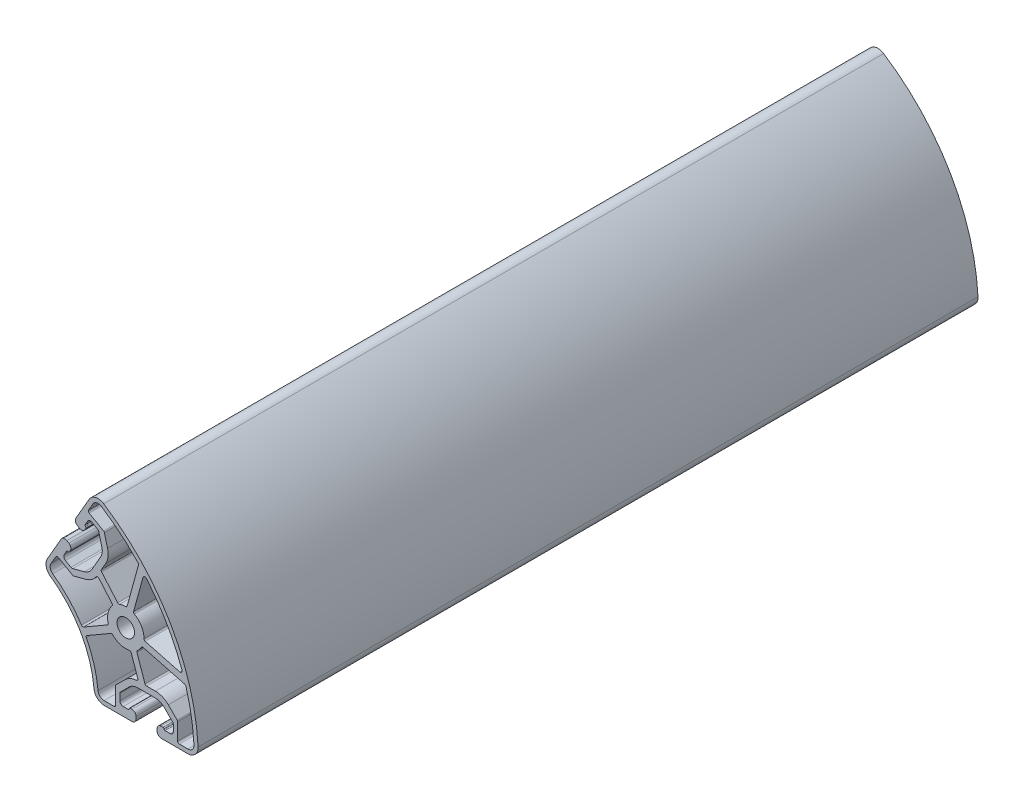
from build123d import *

# Parameters (mm, degrees)
SKETCH1_R      = 3.3782
EXTRUDE1_DEPTH = 300


with BuildPart() as part:
    # Sketch1 → Extrude1 (new body)
    with BuildSketch(Plane.XY):
        with BuildLine():
            Line((13.593641298, -30.057963868), (23.832349548, -30.057963868))
            ThreePointArc((23.832349548, -30.057963868), (26.73425855, -28.810948457), (27.826804928, -25.847425942))
            ThreePointArc((27.826804928, -25.847425942), (17.219715771, 9.94183955), (-8.471171519, 37.022463159))
            ThreePointArc((-8.471171519, 37.022463159), (-11.583933807, 37.558048634), (-14.114834107, 35.668423132))
            Line((-14.114834107, 35.668423132), (-19.234198804, 26.801378173))
            ThreePointArc((-19.234198804, 26.801378173), (-19.344009363, 25.628704588), (-18.618391717, 24.700965008))
            Line((-18.618391717, 24.700965008), (-17.826596053, 24.243823899))
            ThreePointArc((-17.826596053, 24.243823899), (-16.664110244, 24.078097151), (-15.715106965, 24.769639909))
            Line((-15.715106965, 24.769639909), (-15.330123674, 25.436453927))
            ThreePointArc((-15.330123674, 25.436453927), (-15.290506526, 25.718349098), (-15.457829175, 25.948647897))
            Line((-15.457829175, 25.948647897), (-15.482030327, 25.963770381))
            ThreePointArc((-15.482030327, 25.963770381), (-15.649352976, 26.194069181), (-15.609735828, 26.475964352))
            Line((-15.609735828, 26.475964352), (-14.654308342, 28.130821735))
            ThreePointArc((-14.654308342, 28.130821735), (-13.883253955, 28.72247528), (-12.919673935, 28.595619728))
            Line((-12.919673935, 28.595619728), (-10.806489114, 27.375578122))
            ThreePointArc((-10.806489114, 27.375578122), (-10.545730085, 27.146899609), (-10.392331633, 26.835840051))
            Line((-10.392331633, 26.835840051), (-9.189419676, 22.346551148))
            ThreePointArc((-9.189419676, 22.346551148), (-9.068220432, 20.497470542), (-9.663859443, 18.742761874))
            Line((-9.663859443, 18.742761874), (-13.04462575, 12.887073011))
            ThreePointArc((-13.04462575, 12.887073011), (-14.266422378, 11.493874768), (-15.92836916, 10.674288754))
            Line((-15.92836916, 10.674288754), (-20.417658063, 9.471376797))
            ThreePointArc((-20.417658063, 9.471376797), (-20.763742668, 9.448692447), (-21.092164077, 9.560175684))
            Line((-21.092164077, 9.560175684), (-23.205348897, 10.78021729))
            ThreePointArc((-23.205348897, 10.78021729), (-23.797002442, 11.551271677), (-23.670146889, 12.514851697))
            Line((-23.670146889, 12.514851697), (-22.714719404, 14.169709081))
            ThreePointArc((-22.714719404, 14.169709081), (-22.490400372, 14.344967113), (-22.207294306, 14.315212098))
            Line((-22.207294306, 14.315212098), (-22.182097215, 14.301814639))
            ThreePointArc((-22.182097215, 14.301814639), (-21.898991149, 14.272059624), (-21.674672117, 14.447317656))
            Line((-21.674672117, 14.447317656), (-21.321434737, 15.059145864))
            ThreePointArc((-21.321434737, 15.059145864), (-21.164133852, 16.253985089), (-21.897784248, 17.210092529))
            Line((-21.897784248, 17.210092529), (-22.689579912, 17.667233639))
            ThreePointArc((-22.689579912, 17.667233639), (-23.884419136, 17.824534524), (-24.840526577, 17.090884128))
            Line((-24.840526577, 17.090884128), (-30.142896428, 7.906863331))
            ThreePointArc((-30.142896428, 7.906863331), (-30.585488561, 5.047970827), (-28.984595749, 2.638345058))
            ThreePointArc((-28.984595749, 2.638345058), (-17.401655174, -10.046875906), (-12.207365713, -26.420595711))
            ThreePointArc((-12.207365713, -26.420595711), (-10.92100927, -29.0118196), (-8.223837359, -30.057963868))
            Line((-8.223837359, -30.057963868), (2.380942886, -30.057963868))
            ThreePointArc((2.380942886, -30.057963868), (3.494355468, -29.596773276), (3.95554606, -28.483360693))
            Line((3.95554606, -28.483360693), (3.95554606, -27.569074979))
            ThreePointArc((3.95554606, -27.569074979), (3.494355468, -26.455662397), (2.380942886, -25.994471804))
            Line((2.380942886, -25.994471804), (1.674465425, -25.994471804))
            ThreePointArc((1.674465425, -25.994471804), (1.410528237, -26.101109351), (1.294744376, -26.361164159))
            Line((1.294744376, -26.361164159), (1.293748434, -26.389684212))
            ThreePointArc((1.293748434, -26.389684212), (1.177964573, -26.64973902), (0.914027385, -26.756376566))
            Line((0.914027385, -26.756376566), (-0.996834892, -26.756376566))
            ThreePointArc((-0.996834892, -26.756376566), (-1.894748265, -26.384448669), (-2.266676162, -25.486535297))
            Line((-2.266676162, -25.486535297), (-2.266676162, -23.046442757))
            ThreePointArc((-2.266676162, -23.046442757), (-2.199013524, -22.706279706), (-2.006326634, -22.417903395))
            Line((-2.006326634, -22.417903395), (1.280062877, -19.131513885))
            ThreePointArc((1.280062877, -19.131513885), (2.820816305, -18.102015358), (4.638258891, -17.74050355))
            Line((4.638258891, -17.74050355), (11.399817356, -17.74050355))
            ThreePointArc((11.399817356, -17.74050355), (13.217259943, -18.102015358), (14.758013371, -19.131513885))
            Line((14.758013371, -19.131513885), (18.044402882, -22.417903395))
            ThreePointArc((18.044402882, -22.417903395), (18.237089772, -22.706279706), (18.30475241, -23.046442757))
            Line((18.30475241, -23.046442757), (18.30475241, -25.486535297))
            ThreePointArc((18.30475241, -25.486535297), (17.932824513, -26.384448669), (17.03491114, -26.756376566))
            Line((17.03491114, -26.756376566), (15.124048863, -26.756376566))
            ThreePointArc((15.124048863, -26.756376566), (14.860111674, -26.64973902), (14.744327814, -26.389684212))
            Line((14.744327814, -26.389684212), (14.743331872, -26.361164159))
            ThreePointArc((14.743331872, -26.361164159), (14.627548011, -26.101109351), (14.363610823, -25.994471804))
            Line((14.363610823, -25.994471804), (13.593641298, -25.994471804))
            ThreePointArc((13.593641298, -25.994471804), (12.520247113, -26.470563743), (12.082530187, -27.560170325))
            Line((12.082530187, -27.560170325), (12.082530187, -28.474456039))
            ThreePointArc((12.082530187, -28.474456039), (12.52316982, -29.566728171), (13.593641298, -30.057963868))
        make_face()
        Circle(SKETCH1_R, mode=Mode.SUBTRACT)
        with BuildLine():
            Line((4.885272504, 23.307842879), (0.539038586, 7.466054614))
            ThreePointArc((0.539038586, 7.466054614), (0.314157824, 7.130993929), (-0.067205963, 6.999089868))
            ThreePointArc((-0.067205963, 6.999089868), (-1.253984614, 6.886118614), (-2.404382653, 6.573404015))
            ThreePointArc((-2.404382653, 6.573404015), (-2.78165223, 6.555020056), (-3.102618962, 6.754144793))
            Line((-3.102618962, 6.754144793), (-9.307909654, 13.922148845))
            ThreePointArc((-9.307909654, 13.922148845), (-9.459954456, 14.277548768), (-9.377741932, 14.655262718))
            Line((-9.377741932, 14.655262718), (-7.689170351, 17.579954489))
            ThreePointArc((-7.689170351, 17.579954489), (-6.806242453, 20.180976201), (-6.985891356, 22.921888803))
            Line((-6.985891356, 22.921888803), (-8.227464891, 27.555504316))
            ThreePointArc((-8.227464891, 27.555504316), (-8.337566137, 27.778767556), (-8.524725568, 27.942901972))
            Line((-8.524725568, 27.942901972), (-14.055133175, 31.135884293))
            ThreePointArc((-14.055133175, 31.135884293), (-14.350108648, 31.518183474), (-14.290922704, 31.997412248))
            Line((-14.290922704, 31.997412248), (-12.670340481, 34.874966572))
            ThreePointArc((-12.670340481, 34.874966572), (-11.183282681, 36.003961133), (-9.342389262, 35.692382826))
            ThreePointArc((-9.342389262, 35.692382826), (-1.979480434, 30.272893906), (4.702556621, 24.03320903))
            ThreePointArc((4.702556621, 24.03320903), (4.889333782, 23.694561549), (4.885272504, 23.307842879))
        make_face(mode=Mode.SUBTRACT)
        with BuildLine():
            Line((20.747357177, -4.334789213), (7.470325327, -0.836718537))
            ThreePointArc((7.470325327, -0.836718537), (7.123552391, -0.60293307), (6.997375252, -0.204202029))
            ThreePointArc((6.997375252, -0.204202029), (6.063133792, 3.498343997), (3.324696383, 6.15966223))
            ThreePointArc((3.324696383, 6.15966223), (3.042404806, 6.468816154), (3.01389155, 6.886490283))
            Line((3.01389155, 6.886490283), (6.64190205, 20.110392918))
            ThreePointArc((6.64190205, 20.110392918), (7.212195208, 20.651712295), (7.956560659, 20.398372545))
            ThreePointArc((7.956560659, 20.398372545), (15.851338619, 9.131934536), (21.655505364, -3.340907675))
            ThreePointArc((21.655505364, -3.340907675), (21.502039762, -4.112526105), (20.747357177, -4.334789213))
        make_face(mode=Mode.SUBTRACT)
        with BuildLine():
            Line((-19.978599017, 7.201942962), (-15.329059541, 8.44778331))
            ThreePointArc((-15.329059541, 8.44778331), (-13.085325108, 9.503724563), (-11.350539971, 11.275694276))
            ThreePointArc((-11.350539971, 11.275694276), (-10.860984352, 11.552858799), (-10.343405989, 11.332410358))
            Line((-10.343405989, 11.332410358), (-5.275491165, 5.427149851))
            ThreePointArc((-5.275491165, 5.427149851), (-5.12237066, 5.011302087), (-5.27850049, 4.596574793))
            ThreePointArc((-5.27850049, 4.596574793), (-6.827055391, 1.544313394), (-6.743400574, -1.877283279))
            ThreePointArc((-6.743400574, -1.877283279), (-6.767328962, -2.287707445), (-7.037657026, -2.597454603))
            Line((-7.037657026, -2.597454603), (-16.186959662, -7.879738492))
            ThreePointArc((-16.186959662, -7.879738492), (-16.654923298, -7.946726105), (-17.039494542, -7.671803818))
            ThreePointArc((-17.039494542, -7.671803818), (-22.003713265, -1.348807414), (-28.092227765, 3.900358448))
            ThreePointArc((-28.092227765, 3.900358448), (-29.0349645, 5.328238246), (-28.759527, 7.016944098))
            Line((-28.759527, 7.016944098), (-26.857133035, 10.232097497))
            ThreePointArc((-26.857133035, 10.232097497), (-26.471701714, 10.522968415), (-25.993133175, 10.458661752))
            Line((-25.993133175, 10.458661752), (-20.462725568, 7.265679432))
            ThreePointArc((-20.462725568, 7.265679432), (-20.227001279, 7.185661818), (-19.978599017, 7.201942962))
        make_face(mode=Mode.SUBTRACT)
        with BuildLine():
            Line((2.062902293, -7.283472396), (4.643150628, -14.625501447))
            ThreePointArc((4.643150628, -14.625501447), (4.575716349, -15.183280785), (4.092081446, -15.469222128))
            ThreePointArc((4.092081446, -15.469222128), (1.699818655, -16.088001306), (-0.328396874, -17.499436992))
            Line((-0.328396874, -17.499436992), (-3.732096003, -20.903136121))
            ThreePointArc((-3.732096003, -20.903136121), (-3.870397018, -21.110118217), (-3.918961876, -21.354270247))
            Line((-3.918961876, -21.354270247), (-3.918961876, -27.832963868))
            ThreePointArc((-3.918961876, -27.832963868), (-4.10494907, -28.281976674), (-4.553961876, -28.467963868))
            Line((-4.553961876, -28.467963868), (-8.323243189, -28.467963868))
            ThreePointArc((-8.323243189, -28.467963868), (-9.908647493, -27.852608844), (-10.663765411, -26.328809139))
            ThreePointArc((-10.663765411, -26.328809139), (-12.162748305, -18.406030628), (-15.163203266, -10.921737804))
            ThreePointArc((-15.163203266, -10.921737804), (-15.208995945, -10.451231824), (-14.916998406, -10.079465386))
            Line((-14.916998406, -10.079465386), (-5.767669369, -4.797166255))
            ThreePointArc((-5.767669369, -4.797166255), (-5.36425554, -4.717933391), (-4.996855662, -4.902427005))
            ThreePointArc((-4.996855662, -4.902427005), (-2.075510699, -6.685706174), (1.342103479, -6.870785391))
            ThreePointArc((1.342103479, -6.870785391), (1.779331156, -6.942940694), (2.062902293, -7.283472396))
        make_face(mode=Mode.SUBTRACT)
        with BuildLine():
            Line((7.403163154, -15.022146674), (4.298563879, -6.065234245))
            ThreePointArc((4.298563879, -6.065234245), (4.286603153, -5.687705478), (4.49116248, -5.370173573))
            ThreePointArc((4.49116248, -5.370173573), (5.336452594, -4.531133211), (6.027267169, -3.560937699))
            ThreePointArc((6.027267169, -3.560937699), (6.332693828, -3.296547011), (6.735777027, -3.269867151))
            Line((6.735777027, -3.269867151), (22.639874507, -7.460085089))
            ThreePointArc((22.639874507, -7.460085089), (22.976124406, -7.65018504), (23.175499612, -7.98101961))
            ThreePointArc((23.175499612, -7.98101961), (25.235583101, -16.898968849), (26.242413529, -25.99622421))
            ThreePointArc((26.242413529, -25.99622421), (25.599767916, -27.73605098), (23.895568955, -28.467963868))
            Line((23.895568955, -28.467963868), (20.592038124, -28.467963868))
            ThreePointArc((20.592038124, -28.467963868), (20.143025318, -28.281976674), (19.957038124, -27.832963868))
            Line((19.957038124, -27.832963868), (19.957038124, -21.354270247))
            ThreePointArc((19.957038124, -21.354270247), (19.908473266, -21.110118217), (19.77017225, -20.903136121))
            Line((19.77017225, -20.903136121), (16.378130272, -17.511094142))
            ThreePointArc((16.378130272, -17.511094142), (14.094254781, -15.985057328), (11.400239954, -15.449184461))
            Line((11.400239954, -15.449184461), (8.003143752, -15.449184461))
            ThreePointArc((8.003143752, -15.449184461), (7.634925749, -15.331524293), (7.403163154, -15.022146674))
        make_face(mode=Mode.SUBTRACT)
    extrude(amount=-EXTRUDE1_DEPTH)


solid = part.part
